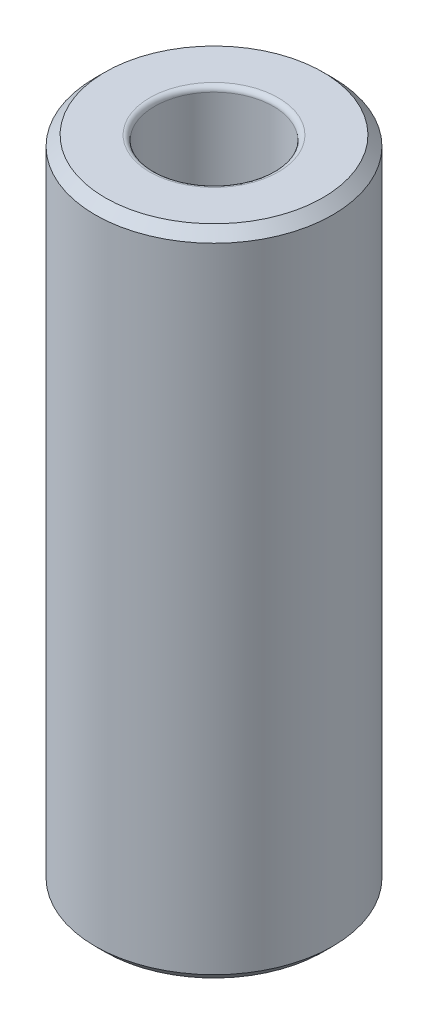
from build123d import *

# Parameters (mm, degrees)
SKETCH1_R           = 3
SKETCH1_R_2         = 1.5
BOSS_EXTRUDE1_DEPTH = 16.5
CHAMFER1_SIZE       = 0.25
FILLET1_R           = 0.125


with BuildPart() as part:
    # Sketch1 → Boss-Extrude1 (new body)
    with BuildSketch(Plane(origin=(0, 0, 0), x_dir=(1, 0, 0), z_dir=(0, 1, 0))):
        with Locations(Location((0, 0, 0), (0, 0, 270))):
            Circle(SKETCH1_R)
        with Locations(Location((0, 0, 0), (0, 0, 270))):
            Circle(SKETCH1_R_2, mode=Mode.SUBTRACT)
    extrude(amount=BOSS_EXTRUDE1_DEPTH)

    # Chamfer1
    chamfer1_edges = [part.edges().sort_by_distance(p)[0] for p in [
        (0, 16.5, -3),
        (0, 0, -3),
    ]]
    chamfer(chamfer1_edges, length=CHAMFER1_SIZE)

    # Fillet1
    fillet1_edges = [part.edges().sort_by_distance(p)[0] for p in [
        (0, 0, -1.5),
        (0, 16.5, -1.5),
    ]]
    fillet(fillet1_edges, radius=FILLET1_R)


solid = part.part
